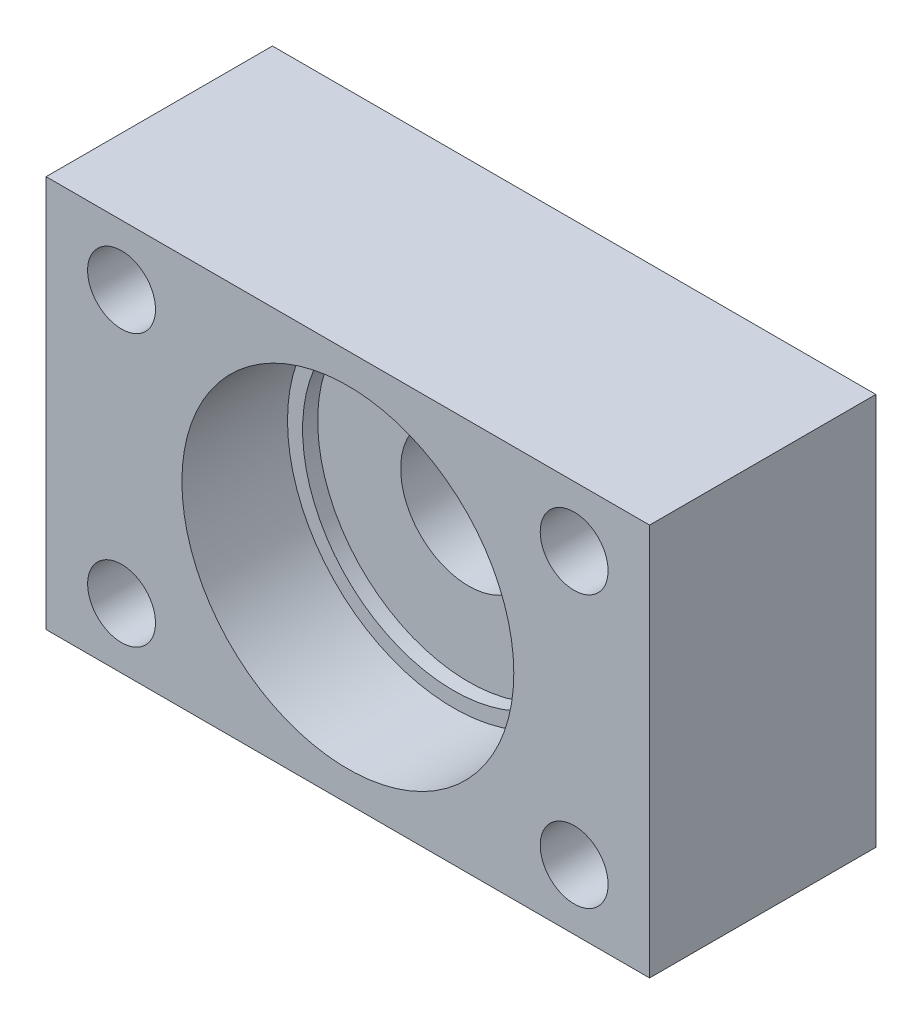
from build123d import *

# Parameters (mm, degrees)
ESQUISSE1_W             = 40
ESQUISSE1_H             = 26
BOSS_EXTRU_1_DEPTH      = 15
ESQUISSE2_R             = 11
ENL_V_MAT_EXTRU_1_DEPTH = 7
ESQUISSE3_R             = 10
ENL_V_MAT_EXTRU_2_DEPTH = 1
ESQUISSE4_R             = 4.5
ENL_V_MAT_EXTRU_3_DEPTH = 7
ESQUISSE5_R             = 2.25
ENL_V_MAT_EXTRU_4_DEPTH = 51.009999


with BuildPart() as part:
    # Esquisse1 → Boss.-Extru.1 (new body)
    with BuildSketch(Plane.XY):
        with Locations((20, 13)):
            Rectangle(ESQUISSE1_W, ESQUISSE1_H)
    extrude(amount=BOSS_EXTRU_1_DEPTH)

    # Esquisse2 → Enlèv. mat.-Extru.1 (cut)
    with BuildSketch(Plane.XY.offset(15)):
        with Locations((20, 13)):
            Circle(ESQUISSE2_R)
    extrude(amount=-ENL_V_MAT_EXTRU_1_DEPTH, mode=Mode.SUBTRACT)

    # Esquisse3 → Enlèv. mat.-Extru.2 (cut)
    with BuildSketch(Plane.XY.offset(8)):
        with Locations((20, 13)):
            Circle(ESQUISSE3_R)
    extrude(amount=-ENL_V_MAT_EXTRU_2_DEPTH, mode=Mode.SUBTRACT)

    # Esquisse4 → Enlèv. mat.-Extru.3 (cut)
    with BuildSketch(Plane.XY.offset(7)):
        with Locations((20, 13)):
            Circle(ESQUISSE4_R)
    extrude(amount=-ENL_V_MAT_EXTRU_3_DEPTH, mode=Mode.SUBTRACT)

    # Esquisse5 → Enlèv. mat.-Extru.4 (cut, through all)
    with BuildSketch(Plane.XY.offset(15)):
        with Locations((5, 22)):
            Circle(ESQUISSE5_R)
        with Locations(Location((5, 4, 0), (0, 0, 180))):
            Circle(ESQUISSE5_R)
        with Locations((35, 4)):
            Circle(ESQUISSE5_R)
        with Locations(Location((35, 22, 0), (0, 0, 180))):
            Circle(ESQUISSE5_R)
    extrude(amount=-ENL_V_MAT_EXTRU_4_DEPTH, mode=Mode.SUBTRACT)


solid = part.part
